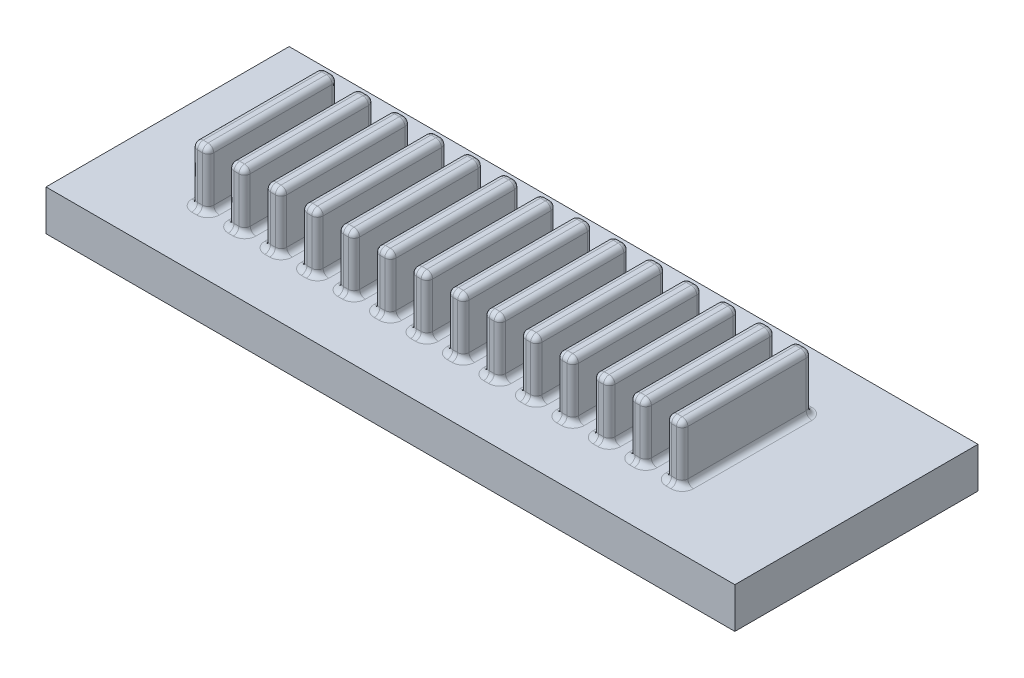
from build123d import *

# Parameters (mm, degrees)
SKETCH1_W           = 85
SKETCH1_H           = 30
BOSS_EXTRUDE1_DEPTH = 5
SKETCH2_W           = 2
SKETCH2_H           = 16
BOSS_EXTRUDE2_DEPTH = 7
FILLET1_R           = 0.7


with BuildPart() as part:
    # Sketch1 → Boss-Extrude1 (new body)
    with BuildSketch(Plane(origin=(0, 0, 0), x_dir=(1, 0, 0), z_dir=(0, 1, 0))):
        with Locations((42.5, 15)):
            Rectangle(SKETCH1_W, SKETCH1_H)
    extrude(amount=BOSS_EXTRUDE1_DEPTH)

    # Sketch2 → Boss-Extrude2 (add)
    with BuildSketch(Plane(origin=(0, 5, 0), x_dir=(1, 0, 0), z_dir=(0, 1, 0))):
        with Locations((12, 15)):
            Rectangle(SKETCH2_W, SKETCH2_H)
        with Locations((16.5, 15)):
            Rectangle(SKETCH2_W, SKETCH2_H)
        with Locations((21, 15)):
            Rectangle(SKETCH2_W, SKETCH2_H)
        with Locations((25.5, 15)):
            Rectangle(SKETCH2_W, SKETCH2_H)
        with Locations((30, 15)):
            Rectangle(SKETCH2_W, SKETCH2_H)
        with Locations((34.5, 15)):
            Rectangle(SKETCH2_W, SKETCH2_H)
        with Locations((39, 15)):
            Rectangle(SKETCH2_W, SKETCH2_H)
        with Locations((43.5, 15)):
            Rectangle(SKETCH2_W, SKETCH2_H)
        with Locations((48, 15)):
            Rectangle(SKETCH2_W, SKETCH2_H)
        with Locations((52.5, 15)):
            Rectangle(SKETCH2_W, SKETCH2_H)
        with Locations((57, 15)):
            Rectangle(SKETCH2_W, SKETCH2_H)
        with Locations((61.5, 15)):
            Rectangle(SKETCH2_W, SKETCH2_H)
        with Locations((66, 15)):
            Rectangle(SKETCH2_W, SKETCH2_H)
        with Locations((70.5, 15)):
            Rectangle(SKETCH2_W, SKETCH2_H)
    extrude(amount=BOSS_EXTRUDE2_DEPTH)

    # Fillet1
    fillet1_edges = [part.edges().sort_by_distance(p)[0] for p in [
        (48, 5, -23),
        (49, 8.5, -23),
        (47, 5, -15),
        (47, 8.5, -23),
        (48, 5, -7),
        (47, 8.5, -7),
        (49, 5, -15),
        (49, 8.5, -7),
        (48, 12, -23),
        (47, 12, -15),
        (48, 12, -7),
        (49, 12, -15),
        (52.5, 5, -23),
        (53.5, 8.5, -23),
        (51.5, 5, -15),
        (51.5, 8.5, -23),
        (52.5, 5, -7),
        (51.5, 8.5, -7),
        (53.5, 5, -15),
        (53.5, 8.5, -7),
        (52.5, 12, -23),
        (51.5, 12, -15),
        (52.5, 12, -7),
        (53.5, 12, -15),
        (57, 5, -23),
        (58, 8.5, -23),
        (56, 5, -15),
        (56, 8.5, -23),
        (57, 5, -7),
        (56, 8.5, -7),
        (58, 5, -15),
        (58, 8.5, -7),
        (57, 12, -23),
        (56, 12, -15),
        (57, 12, -7),
        (58, 12, -15),
        (61.5, 5, -23),
        (62.5, 8.5, -23),
        (60.5, 5, -15),
        (60.5, 8.5, -23),
        (61.5, 5, -7),
        (60.5, 8.5, -7),
        (62.5, 5, -15),
        (62.5, 8.5, -7),
        (61.5, 12, -23),
        (60.5, 12, -15),
        (61.5, 12, -7),
        (62.5, 12, -15),
        (66, 5, -23),
        (67, 8.5, -23),
        (65, 5, -15),
        (65, 8.5, -23),
        (66, 5, -7),
        (65, 8.5, -7),
        (67, 5, -15),
        (67, 8.5, -7),
        (66, 12, -23),
        (65, 12, -15),
        (66, 12, -7),
        (67, 12, -15),
        (70.5, 5, -23),
        (71.5, 8.5, -23),
        (69.5, 5, -15),
        (69.5, 8.5, -23),
        (70.5, 5, -7),
        (69.5, 8.5, -7),
        (71.5, 5, -15),
        (71.5, 8.5, -7),
        (70.5, 12, -23),
        (69.5, 12, -15),
        (70.5, 12, -7),
        (71.5, 12, -15),
        (11, 5, -15),
        (11, 8.5, -23),
        (12, 5, -7),
        (11, 8.5, -7),
        (13, 5, -15),
        (13, 8.5, -7),
        (12, 5, -23),
        (13, 8.5, -23),
        (11, 12, -15),
        (12, 12, -7),
        (13, 12, -15),
        (12, 12, -23),
        (16.5, 5, -23),
        (17.5, 8.5, -23),
        (15.5, 5, -15),
        (15.5, 8.5, -23),
        (16.5, 5, -7),
        (15.5, 8.5, -7),
        (17.5, 5, -15),
        (17.5, 8.5, -7),
        (16.5, 12, -23),
        (15.5, 12, -15),
        (16.5, 12, -7),
        (17.5, 12, -15),
        (21, 5, -23),
        (22, 8.5, -23),
        (20, 5, -15),
        (20, 8.5, -23),
        (21, 5, -7),
        (20, 8.5, -7),
        (22, 5, -15),
        (22, 8.5, -7),
        (21, 12, -23),
        (20, 12, -15),
        (21, 12, -7),
        (22, 12, -15),
        (25.5, 5, -23),
        (26.5, 8.5, -23),
        (24.5, 5, -15),
        (24.5, 8.5, -23),
        (25.5, 5, -7),
        (24.5, 8.5, -7),
        (26.5, 5, -15),
        (26.5, 8.5, -7),
        (25.5, 12, -23),
        (24.5, 12, -15),
        (25.5, 12, -7),
        (26.5, 12, -15),
        (30, 5, -23),
        (31, 8.5, -23),
        (29, 5, -15),
        (29, 8.5, -23),
        (30, 5, -7),
        (29, 8.5, -7),
        (31, 5, -15),
        (31, 8.5, -7),
        (30, 12, -23),
        (29, 12, -15),
        (30, 12, -7),
        (31, 12, -15),
        (34.5, 5, -23),
        (35.5, 8.5, -23),
        (33.5, 5, -15),
        (33.5, 8.5, -23),
        (34.5, 5, -7),
        (33.5, 8.5, -7),
        (35.5, 5, -15),
        (35.5, 8.5, -7),
        (34.5, 12, -23),
        (33.5, 12, -15),
        (34.5, 12, -7),
        (35.5, 12, -15),
        (39, 5, -23),
        (40, 8.5, -23),
        (38, 5, -15),
        (38, 8.5, -23),
        (39, 5, -7),
        (38, 8.5, -7),
        (40, 5, -15),
        (40, 8.5, -7),
        (39, 12, -23),
        (38, 12, -15),
        (39, 12, -7),
        (40, 12, -15),
        (43.5, 5, -23),
        (44.5, 8.5, -23),
        (42.5, 5, -15),
        (42.5, 8.5, -23),
        (43.5, 5, -7),
        (42.5, 8.5, -7),
        (44.5, 5, -15),
        (44.5, 8.5, -7),
        (43.5, 12, -23),
        (42.5, 12, -15),
        (43.5, 12, -7),
        (44.5, 12, -15),
    ]]
    fillet(fillet1_edges, radius=FILLET1_R)


solid = part.part
